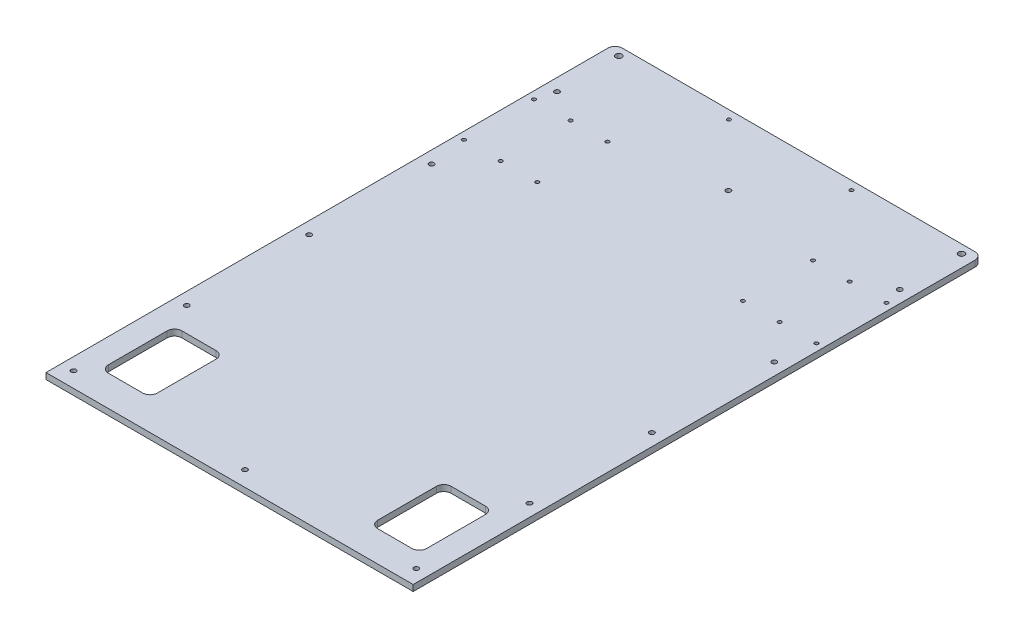
from build123d import *

# Parameters (mm, degrees)
SKETCH1_R           = 2
SKETCH1_R_2         = 1.5
SKETCH1_R_3         = 2.5
SKETCH1_W           = 40
SKETCH1_H           = 60
BOSS_EXTRUDE1_DEPTH = 5
FILLET1_R           = 6


with BuildPart() as part:
    # Sketch1 → Boss-Extrude1 (new body)
    with BuildSketch(Plane(origin=(0, 0, 0), x_dir=(1, 0, 0), z_dir=(0, 1, 0))):
        Polygon((-150, -210), (150, -210), (150, 210), (150, 255), (-150, 255), (-150, 210), align=None)
        with Locations(Location((0, -197.5, 0), (0, 0, 270))):
            Circle(SKETCH1_R, mode=Mode.SUBTRACT)
        with Locations(Location((-140, -197.5, 0), (0, 0, 270))):
            Circle(SKETCH1_R, mode=Mode.SUBTRACT)
        with Locations(Location((-140, 197.5, 0), (0, 0, 270))):
            Circle(SKETCH1_R, mode=Mode.SUBTRACT)
        with Locations(Location((0, 197.5, 0), (0, 0, 270))):
            Circle(SKETCH1_R, mode=Mode.SUBTRACT)
        with Locations(Location((-140, -5, 0), (0, 0, 270))):
            Circle(SKETCH1_R, mode=Mode.SUBTRACT)
        with Locations(Location((-140, 95, 0), (0, 0, 270))):
            Circle(SKETCH1_R, mode=Mode.SUBTRACT)
        with Locations(Location((140, 197.5, 0), (0, 0, 270))):
            Circle(SKETCH1_R, mode=Mode.SUBTRACT)
        with Locations(Location((140, -197.5, 0), (0, 0, 270))):
            Circle(SKETCH1_R, mode=Mode.SUBTRACT)
        with Locations(Location((-114, 182.625, 0), (0, 0, 270))):
            Circle(SKETCH1_R_2, mode=Mode.SUBTRACT)
        with Locations(Location((-144, 182.625, 0), (0, 0, 270))):
            Circle(SKETCH1_R_2, mode=Mode.SUBTRACT)
        with Locations(Location((-84, 182.625, 0), (0, 0, 270))):
            Circle(SKETCH1_R_2, mode=Mode.SUBTRACT)
        with Locations(Location((-84, 125.375, 0), (0, 0, 270))):
            Circle(SKETCH1_R_2, mode=Mode.SUBTRACT)
        with Locations(Location((-114, 125.375, 0), (0, 0, 270))):
            Circle(SKETCH1_R_2, mode=Mode.SUBTRACT)
        with Locations(Location((-144, 125.375, 0), (0, 0, 270))):
            Circle(SKETCH1_R_2, mode=Mode.SUBTRACT)
        with Locations(Location((-140, -105, 0), (0, 0, 270))):
            Circle(SKETCH1_R, mode=Mode.SUBTRACT)
        with Locations(Location((-140, 248, 0), (0, 0, 270))):
            Circle(SKETCH1_R_3, mode=Mode.SUBTRACT)
        with Locations(Location((-50, 248, 0), (0, 0, 270))):
            Circle(SKETCH1_R_2, mode=Mode.SUBTRACT)
        with Locations(Location((140, -105, 0), (0, 0, 270))):
            Circle(SKETCH1_R, mode=Mode.SUBTRACT)
        with Locations(Location((140, 95, 0), (0, 0, 270))):
            Circle(SKETCH1_R, mode=Mode.SUBTRACT)
        with Locations(Location((140, -5, 0), (0, 0, 270))):
            Circle(SKETCH1_R, mode=Mode.SUBTRACT)
        with Locations(Location((144, 125.375, 0), (0, 0, 270))):
            Circle(SKETCH1_R_2, mode=Mode.SUBTRACT)
        with Locations(Location((114, 125.375, 0), (0, 0, 270))):
            Circle(SKETCH1_R_2, mode=Mode.SUBTRACT)
        with Locations(Location((84, 125.375, 0), (0, 0, 270))):
            Circle(SKETCH1_R_2, mode=Mode.SUBTRACT)
        with Locations(Location((84, 182.625, 0), (0, 0, 270))):
            Circle(SKETCH1_R_2, mode=Mode.SUBTRACT)
        with Locations(Location((144, 182.625, 0), (0, 0, 270))):
            Circle(SKETCH1_R_2, mode=Mode.SUBTRACT)
        with Locations(Location((114, 182.625, 0), (0, 0, 270))):
            Circle(SKETCH1_R_2, mode=Mode.SUBTRACT)
        with Locations(Location((50, 248, 0), (0, 0, 270))):
            Circle(SKETCH1_R_2, mode=Mode.SUBTRACT)
        with Locations(Location((140, 248, 0), (0, 0, 270))):
            Circle(SKETCH1_R_3, mode=Mode.SUBTRACT)
        with Locations((-110, -155)):
            Rectangle(SKETCH1_W, SKETCH1_H, mode=Mode.SUBTRACT)
        with Locations((110, -155)):
            Rectangle(SKETCH1_W, SKETCH1_H, mode=Mode.SUBTRACT)
    extrude(amount=BOSS_EXTRUDE1_DEPTH)

    # Fillet1
    fillet1_edges = [part.edges().sort_by_distance(p)[0] for p in [
        (130, 2.5, 185),
        (130, 2.5, 125),
        (90, 2.5, 125),
        (90, 2.5, 185),
        (-90, 2.5, 125),
        (-130, 2.5, 125),
        (-130, 2.5, 185),
        (-90, 2.5, 185),
        (-150, 2.5, -255),
        (150, 2.5, -255),
    ]]
    fillet(fillet1_edges, radius=FILLET1_R)


solid = part.part
